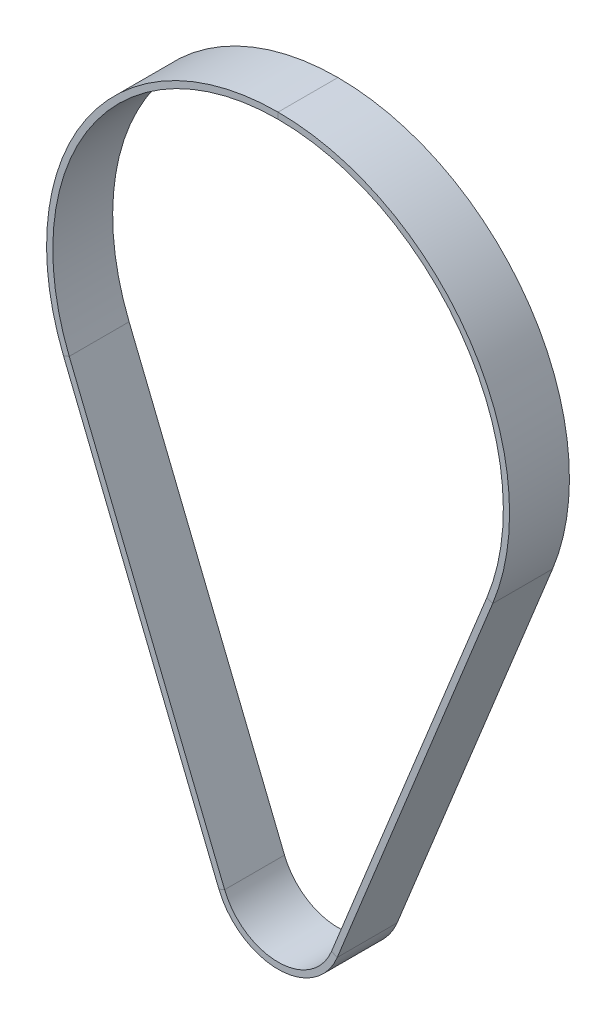
from build123d import *

# Parameters (mm, degrees)
SKETCH_2_W = 15
SKETCH_2_H = 1.56


with BuildPart() as part:
    # По траектории1: sweep along a path in Эскиз1
    with BuildLine(Plane.XY) as sweep_1_path:
        Line((-53.767439031, -21.75), (-14.832396974, -118))
        ThreePointArc((-14.832396974, -118), (0, -128), (14.832396974, -118))
        Line((14.832396974, -118), (53.767439031, -21.75))
        ThreePointArc((53.767439031, -21.75), (0, 58), (-53.767439031, -21.75))
    # Эскиз2 → По траектории1 (sweep)
    with BuildSketch(Plane(origin=(0, 0, 0), x_dir=(0, 0, -1), z_dir=(1, 0, 0))):
        with Locations((-7.5, 57.22)):
            Rectangle(SKETCH_2_W, SKETCH_2_H)
    sweep(path=sweep_1_path.line)


solid = part.part
